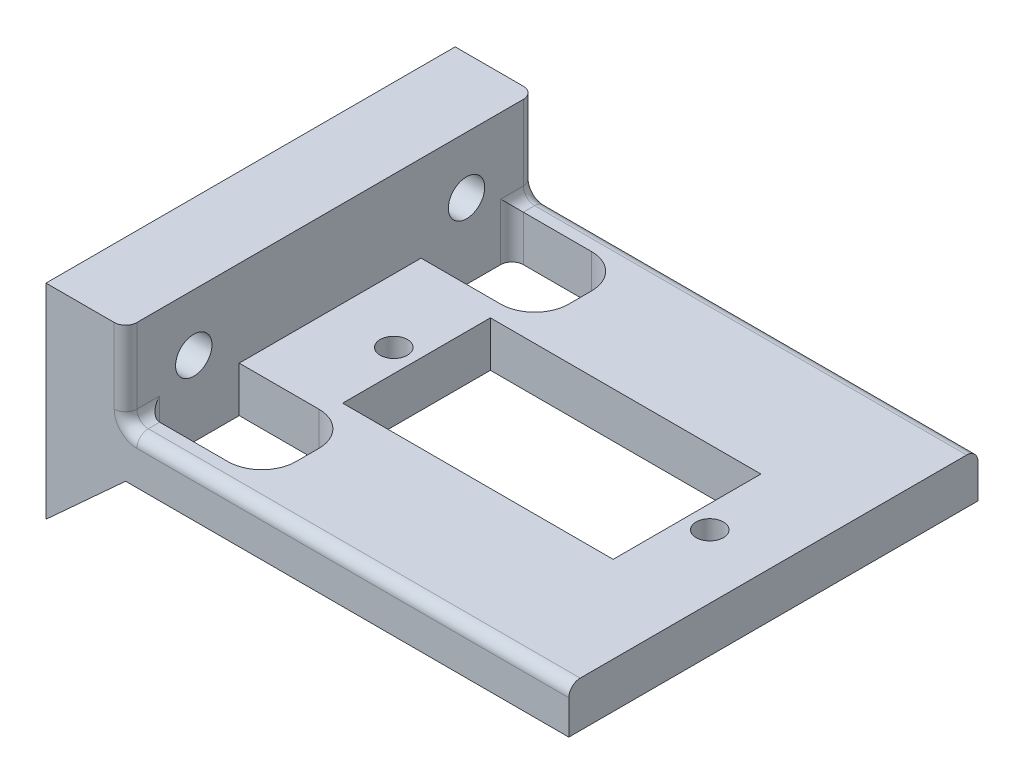
from build123d import *

# Parameters (mm, degrees)
SERVO_SHELF_START                 = 21.4
SERVO_SHELF_PROFILE_W             = 46
SERVO_SHELF_PROFILE_H             = 36
SERVO_SHELF_DEPTH                 = 4
REAR_CLAMPING_BLOCK_START         = -18
REAR_CLAMPING_BLOCK_PROFILE_W     = 7
REAR_CLAMPING_BLOCK_PROFILE_H     = 10
REAR_CLAMPING_BLOCK_DEPTH         = 36
SERVO_BODY_WINDOW_START           = 20.4
SERVO_BODY_WINDOW_PROFILE_W       = 23.8
SERVO_BODY_WINDOW_PROFILE_H       = 13
SERVO_BODY_WINDOW_DEPTH           = 25.744213361
LEFT_NUT_ACCESS_START             = 20
LEFT_NUT_ACCESS_PROFILE_W         = 10
LEFT_NUT_ACCESS_PROFILE_H         = 8
LEFT_NUT_ACCESS_DEPTH             = 26.144213361
RIGHT_NUT_ACCESS_START            = 20
RIGHT_NUT_ACCESS_PROFILE_W        = 10
RIGHT_NUT_ACCESS_PROFILE_H        = 8
RIGHT_NUT_ACCESS_DEPTH            = 26.144213361
REAR_CLAMPING_M3_HOLES_START      = -25
REAR_CLAMPING_M3_PROFILE_R        = 1.6
REAR_CLAMPING_M3_HOLES_DEPTH      = 11
FILLET1_R                         = 3
FILLET2_R                         = 1
BOSS_EXTRUDE1_START               = -36
BOSS_EXTRUDE1_DEPTH               = 36
OWNED_SG90_M2_EAR_HOLES_START     = 20.4
OWNED_SG90_M2_EAR_HOLES_PROFILE_R = 1.2
OWNED_SG90_M2_EAR_HOLES_DEPTH     = 25.744213361


with BuildPart() as part:
    # Servo_shelf_profile → Servo_shelf (new body)
    with BuildSketch(Plane(origin=(0, 0, 0), x_dir=(1, 0, 0), z_dir=(0, 1, 0)).offset(SERVO_SHELF_START)):
        with Locations((2, 0)):
            Rectangle(SERVO_SHELF_PROFILE_W, SERVO_SHELF_PROFILE_H)
    extrude(amount=SERVO_SHELF_DEPTH)

    # Rear_clamping_block_profile → Rear_clamping_block (add)
    with BuildSketch(Plane.XY.offset(REAR_CLAMPING_BLOCK_START)):
        with Locations((-17.5, 28)):
            Rectangle(REAR_CLAMPING_BLOCK_PROFILE_W, REAR_CLAMPING_BLOCK_PROFILE_H)
    extrude(amount=REAR_CLAMPING_BLOCK_DEPTH)

    # Servo_body_window_profile → Servo_body_window (cut, through all)
    with BuildSketch(Plane(origin=(0, 0, 0), x_dir=(1, 0, 0), z_dir=(0, 1, 0)).offset(SERVO_BODY_WINDOW_START)):
        with Locations((5.5, 0)):
            Rectangle(SERVO_BODY_WINDOW_PROFILE_W, SERVO_BODY_WINDOW_PROFILE_H)
    extrude(amount=SERVO_BODY_WINDOW_DEPTH, mode=Mode.SUBTRACT)

    # Left_nut_access_profile → Left_nut_access (cut, through all)
    with BuildSketch(Plane(origin=(0, 0, 0), x_dir=(1, 0, 0), z_dir=(0, 1, 0)).offset(LEFT_NUT_ACCESS_START)):
        with Locations((-9, 12)):
            Rectangle(LEFT_NUT_ACCESS_PROFILE_W, LEFT_NUT_ACCESS_PROFILE_H)
    extrude(amount=LEFT_NUT_ACCESS_DEPTH, mode=Mode.SUBTRACT)

    # Right_nut_access_profile → Right_nut_access (cut, through all)
    with BuildSketch(Plane(origin=(0, 0, 0), x_dir=(1, 0, 0), z_dir=(0, 1, 0)).offset(RIGHT_NUT_ACCESS_START)):
        with Locations((-9, -12)):
            Rectangle(RIGHT_NUT_ACCESS_PROFILE_W, RIGHT_NUT_ACCESS_PROFILE_H)
    extrude(amount=RIGHT_NUT_ACCESS_DEPTH, mode=Mode.SUBTRACT)

    # Rear_clamping_M3_profile → Rear_clamping_M3_holes (cut)
    with BuildSketch(Plane(origin=(0, 0, 0), x_dir=(0, 0, -1), z_dir=(1, 0, 0)).offset(REAR_CLAMPING_M3_HOLES_START)):
        with Locations((12, 28)):
            Circle(REAR_CLAMPING_M3_PROFILE_R)
        with Locations((-12, 28)):
            Circle(REAR_CLAMPING_M3_PROFILE_R)
    extrude(amount=REAR_CLAMPING_M3_HOLES_DEPTH, mode=Mode.SUBTRACT)

    # Fillet1
    fillet1_edges = [part.edges().sort_by_distance(p)[0] for p in [
        (-4, 23.4, -8),
        (-4, 23.4, -16),
        (-4, 23.4, 16),
        (-4, 23.4, 8),
    ]]
    fillet(fillet1_edges, radius=FILLET1_R)

    # Fillet2
    fillet2_edges = [part.edges().sort_by_distance(p)[0] for p in [
        (5.5, 25.4, 18),
        (-14, 25.4, 17),
        (5.5, 25.4, -18),
        (-14, 29.2, 18),
        (-14, 29.2, -18),
        (-14, 25.4, -17),
        (-14, 23.4, -16),
        (-14, 23.4, 16),
    ]]
    fillet(fillet2_edges, radius=FILLET2_R)

    # Sketch1 → Boss-Extrude1 (add)
    with BuildSketch(Plane(origin=(0, 0, -18), x_dir=(-1, 0, 0), z_dir=(0, 0, -1)).offset(BOSS_EXTRUDE1_START)):
        Polygon((14, 21.4), (21, 15), (21, 21.4), align=None)
    extrude(amount=BOSS_EXTRUDE1_DEPTH)

    # Owned_SG90_M2_ear_holes_profile → Owned_SG90_M2_ear_holes (cut, through all)
    with BuildSketch(Plane(origin=(0, 0, 0), x_dir=(1, 0, 0), z_dir=(0, 1, 0)).offset(OWNED_SG90_M2_EAR_HOLES_START)):
        with Locations(Location((-8.4, 0, 0), (0, 0, 90))):
            Circle(OWNED_SG90_M2_EAR_HOLES_PROFILE_R)
        with Locations(Location((19.4, 0, 0), (0, 0, 90))):
            Circle(OWNED_SG90_M2_EAR_HOLES_PROFILE_R)
    extrude(amount=OWNED_SG90_M2_EAR_HOLES_DEPTH, mode=Mode.SUBTRACT)


solid = part.part
